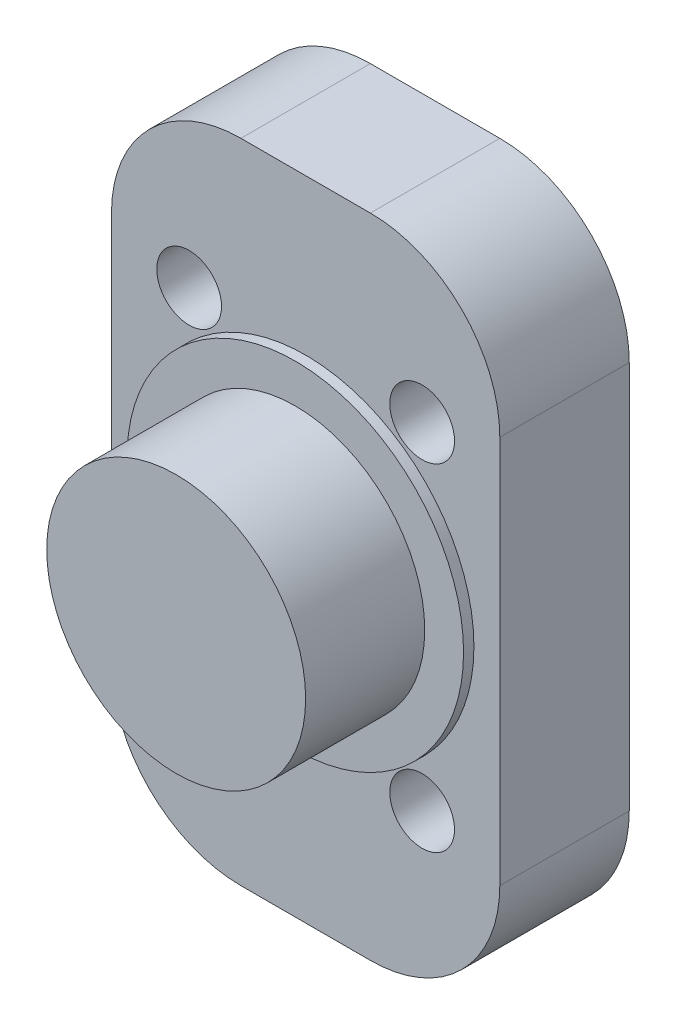
from build123d import *

# Parameters (mm, degrees)
SKETCH_1_W      = 15
SKETCH_1_H      = 25
EXTRUDE_1_DEPTH = 5
SKETCH_1_3_R    = 6.5
EXTRUDE_2_DEPTH = 0.4
SKETCH_1_4_R    = 5
EXTRUDE_3_DEPTH = 5
M3X0_5_1_D      = 2.5
FILLET_1_R      = 5


with BuildPart() as part:
    # ｽｹｯﾁ1 → ﾎﾞｽ - 押し出し1 (new body)
    with BuildSketch(Plane.XY):
        Rectangle(SKETCH_1_W, SKETCH_1_H)
    extrude(amount=-EXTRUDE_1_DEPTH)

    # ｽｹｯﾁ1<3> → ﾎﾞｽ - 押し出し2 (add)
    with BuildSketch(Plane.XY):
        Circle(SKETCH_1_3_R)
    extrude(amount=EXTRUDE_2_DEPTH)

    # ｽｹｯﾁ1<4> → ﾎﾞｽ - 押し出し3 (add)
    with BuildSketch(Plane.XY):
        Circle(SKETCH_1_4_R)
    extrude(amount=EXTRUDE_3_DEPTH)

    # M3x0.5 ねじ穴用ねじ下穴ﾄﾞﾘﾙ1 (through all)
    with Locations(Plane(origin=(-4.5, 6.5, 0), x_dir=(1, 0, 0), z_dir=(0, 0, 1))):
        with Locations((0, 0), (9, 0), (9, -13), (0, -13)):
            Hole(M3X0_5_1_D / 2)

    # ﾌｨﾚｯﾄ1
    fillet_1_edges = [part.edges().sort_by_distance(p)[0] for p in [
        (-7.5, -12.5, -2.5),
        (7.5, -12.5, -2.5),
        (7.5, 12.5, -2.5),
        (-7.5, 12.5, -2.5),
    ]]
    fillet(fillet_1_edges, radius=FILLET_1_R)


solid = part.part
